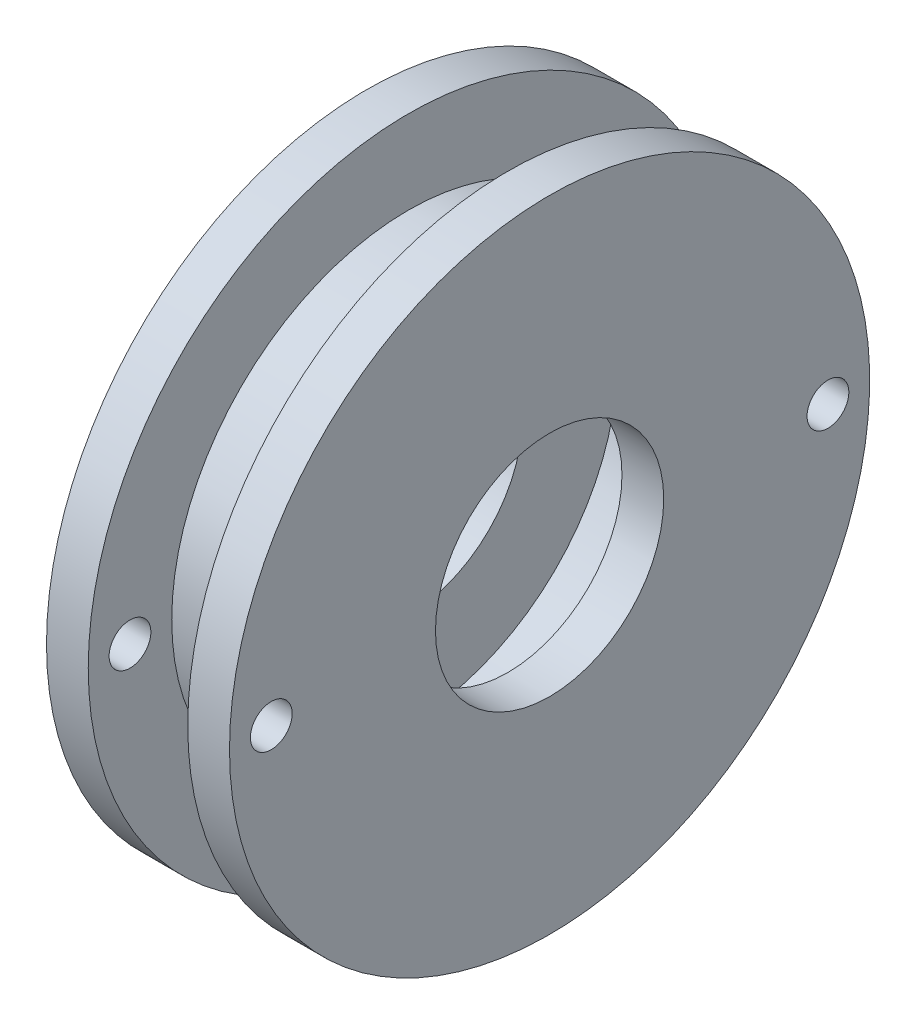
from build123d import *

# Parameters (mm, degrees)
SKETCH_2_R          = 1.5
CUT_EXTRUDE_1_DEPTH = 30


with BuildPart() as part:
    # 草图1 → 旋转1 (revolve)
    with BuildSketch(Plane.XY, mode=Mode.PRIVATE) as revolve_1_sk:
        Polygon((-3.575, 15), (3.575, 15), (3.575, 8.2), (6.575, 8.2), (6.575, 23), (3.575, 23), (3.575, 17), (-3.575, 17), (-3.575, 23), (-6.575, 23), (-6.575, 8.2), (-3.575, 8.2), align=None)
    revolve(revolve_1_sk.sketch.rotate(Axis((0, 0, 0), (1, 0, 0)), 90), axis=Axis((0, 0, 0), (1, 0, 0)))

    # 草图2 → 切除-拉伸1 (cut)
    with BuildSketch(Plane.ZY.offset(6.575)):
        with Locations((20, 0)):
            Circle(SKETCH_2_R)
        with Locations((-20, 0)):
            Circle(SKETCH_2_R)
    extrude(amount=-CUT_EXTRUDE_1_DEPTH, mode=Mode.SUBTRACT)


solid = part.part
